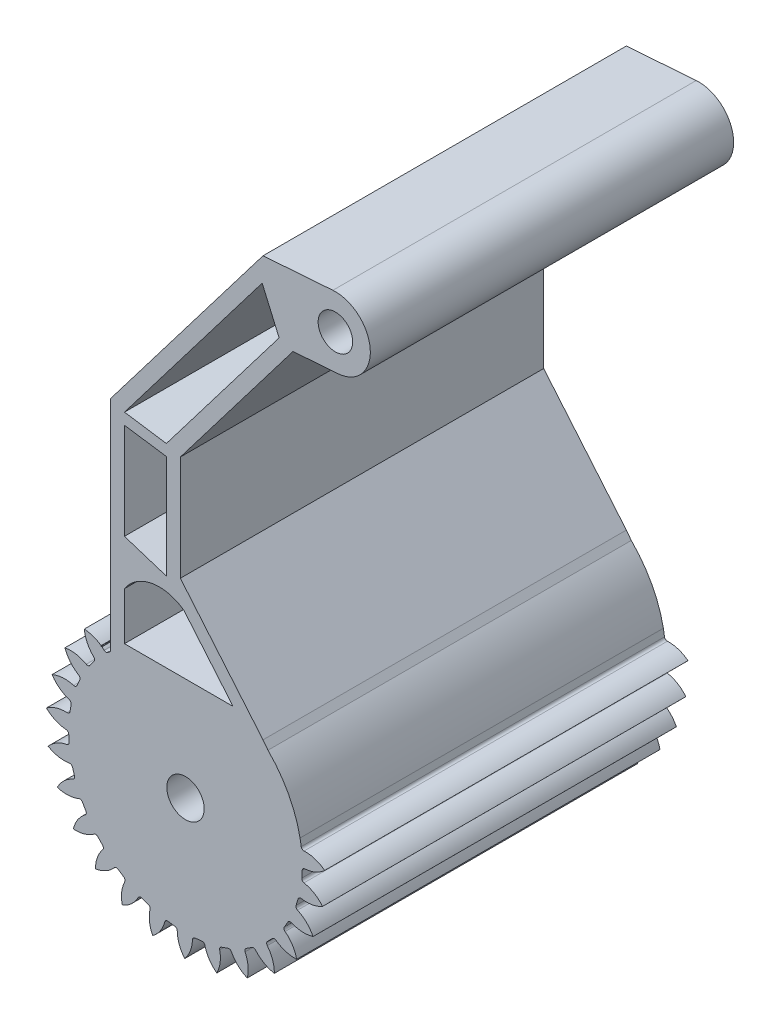
from build123d import *

# Parameters (mm, degrees)
SKETCH1_R                = 12.665001162
BOSS_EXTRUDE1_DEPTH      = 16.51
CUT_EXTRUDE1_DEPTH       = 25.359487041
FILLET1_R                = 0.255000023
CIRPATTERN1_COUNT        = 25
CIRPATTERN1_ANGLE        = 319.44
FILLET1_OF_CIRPATTERN1_R = 0.255000023
M3_CLEARANCE_HOLE1_D     = 3.4
SKETCH7_W                = 15.433030704
SKETCH7_H                = 5.386211439
CUT_EXTRUDE2_DEPTH       = 38.559608464
CLAW_PART_DEPTH          = 16.51
CLAW_PART_DEPTH_BACK     = 16.51
SKETCH8_R                = 1.57
CUT_EXTRUDE3_DEPTH       = 60.591620603


with BuildPart() as part:
    # Sketch1 → Boss-Extrude1 (new, symmetric)
    with BuildSketch(Plane.XY):
        Circle(SKETCH1_R)
    extrude(amount=BOSS_EXTRUDE1_DEPTH, both=True)

    # Sketch3 → Cut-Extrude1 (cut, symmetric)
    with BuildSketch(Plane.XY):
        with BuildLine():
            Line((-0.549568511, 10.61077849), (0.549568511, 10.61077849))
            ThreePointArc((0.549568511, 10.61077849), (1.298156627, 12.409330788), (3.016068488, 13.328000136))
            ThreePointArc((3.016068488, 13.328000136), (0, 13.665001162), (-3.016068488, 13.328000136))
            ThreePointArc((-3.016068488, 13.328000136), (-1.298156627, 12.409330788), (-0.549568511, 10.61077849))
        make_face()
    cut_extrude1 = extrude(amount=CUT_EXTRUDE1_DEPTH, both=True, mode=Mode.SUBTRACT)

    # Fillet1
    fillet1_edges = [part.edges().sort_by_distance(p)[0] for p in [
        (-0.549568511, 10.61077849, 0),
        (0.549568511, 10.61077849, 0),
    ]]
    fillet(fillet1_edges, radius=FILLET1_R)

    # CirPattern1: Cut-Extrude1 ×25 about axis, 5 skipped
    cirpattern1_axis = Axis((0, 0, 16.51), (0, 0, 1))
    add([cut_extrude1.rotate(cirpattern1_axis, i * CIRPATTERN1_ANGLE / (CIRPATTERN1_COUNT - 1)) for i in range(1, CIRPATTERN1_COUNT) if i not in (1, 2, 22, 23, 24)], mode=Mode.SUBTRACT)

    # Fillet1 of CirPattern1
    fillet1_of_cirpattern1_edges = [part.edges().sort_by_distance(p)[0] for p in [
        (-7.231966402, 7.783913391, 0),
        (-6.389116056, 8.489395841, 0),
        (-8.829715746, 5.909887103, 0),
        (-8.171921327, 6.79046004, 0),
        (-9.95310992, 3.718366394, 0),
        (-9.515709846, 4.726723161, 0),
        (-10.541797285, 1.327085424, 0),
        (-10.34828982, 2.409054488, 0),
        (-10.564152032, -1.135490008, 0),
        (-10.624932897, -0.038034824, 0),
        (-10.018973207, -3.537063979, 0),
        (-10.330777097, -2.483080806, 0),
        (-8.935549227, -5.748617724, 0),
        (-9.48162523, -4.794729265, 0),
        (-7.372084429, -7.651340856, 0),
        (-8.12309593, -6.848792465, 0),
        (-5.412572187, -9.143014166, 0),
        (-6.328172905, -8.53492082, 0),
        (-3.162282567, -10.143501106, 0),
        (-4.193284064, -9.762531151, 0),
        (-0.742106948, -10.599052929, 0),
        (-1.833121156, -10.465673057, 0),
        (1.717936576, -10.485196214, 0),
        (0.625521761, -10.606571937, 0),
        (4.085688104, -9.808047636, 0),
        (3.050560032, -10.177658336, 0),
        (6.233945898, -8.603985371, 0),
        (5.311714327, -9.201974605, 0),
        (8.047299994, -6.937694756, 0),
        (7.287509589, -7.731936996, 0),
        (9.428332319, -4.898693234, 0),
        (8.871800987, -5.846519732, 0),
        (10.302850245, -2.59652124, 0),
        (9.979476287, -3.647012305, 0),
        (10.623872406, -0.154857409, 0),
        (10.551028309, -1.251577944, 0),
        (10.374152662, 2.295125762, 0),
        (10.555751798, 1.211094421, 0),
    ]]
    fillet(fillet1_of_cirpattern1_edges, radius=FILLET1_OF_CIRPATTERN1_R)

    # M3 Clearance Hole1 (through all)
    with Locations(Plane.XY.offset(16.51)):
        with Locations((0, 0)):
            Hole(M3_CLEARANCE_HOLE1_D / 2)

    # Sketch7 → Cut-Extrude2 (cut, through all)
    with BuildSketch(Plane.XY.offset(16.51)):
        with Locations((0.047493999, 10.802685467)):
            Rectangle(SKETCH7_W, SKETCH7_H)
    extrude(amount=-CUT_EXTRUDE2_DEPTH, mode=Mode.SUBTRACT)

    # Sketch8 → claw part (add, two sides: drawn at the far end of the back side and taken through both)
    with BuildSketch(Plane.XY.offset(-CLAW_PART_DEPTH_BACK)):
        with BuildLine():
            Line((-6.817397681, 8.109579748), (-6.817397681, 28.032410915))
            Line((-6.817397681, 28.032410915), (7.045146575, 46.209579748))
            Line((7.045146575, 46.209579748), (13.395146575, 46.667743656))
            ThreePointArc((13.395146575, 46.667743656), (16.790402351, 43.729463851), (13.852122546, 40.334208075))
            Line((13.852122546, 40.334208075), (9.772359499, 40.039845841))
            Line((9.772359499, 40.039845841), (-0.467397681, 26.613032435))
            Line((-0.467397681, 26.613032435), (-0.467397681, 17.068770643))
            Line((-0.467397681, 17.068770643), (7.045146575, 8.109579748))
            Line((7.045146575, 8.109579748), (-6.817397681, 8.109579748))
        make_face()
        with Locations((13.62363456, 43.500975865)):
            Circle(SKETCH8_R, mode=Mode.SUBTRACT)
        with BuildLine():
            Line((-5.547397681, 9.379579748), (-5.547397681, 13.711072783))
            ThreePointArc((-5.547397681, 13.711072783), (-3.054532927, 15.375603898), (-0.135101553, 14.69592826))
            Line((-0.135101553, 14.69592826), (4.322812554, 9.379579748))
            Line((4.322812554, 9.379579748), (0.994520613, 9.379579748))
            Line((0.994520613, 9.379579748), (-5.547397681, 9.379579748))
        make_face(mode=Mode.SUBTRACT)
        Polygon((-5.547397681, 27.603399078), (6.968906648, 44.015319773), (8.50914458, 40.47775457), (-1.737397681, 27.042044272), align=None, mode=Mode.SUBTRACT)
        Polygon((-1.737397681, 26.015075685), (-1.737397681, 16.606769168), (-5.547397681, 17.830759902), (-5.547397681, 26.576430491), align=None, mode=Mode.SUBTRACT)
    extrude(amount=CLAW_PART_DEPTH + CLAW_PART_DEPTH_BACK)

    # Sketch9 → Cut-Extrude3 (cut, through all)
    with BuildSketch(Plane.XY.offset(16.51)):
        with BuildLine():
            Line((7.045146575, 8.109579748), (7.496898651, 7.515682795))
            ThreePointArc((7.496898651, 7.515682795), (9.449584642, 4.836768277), (10.480735691, 1.686166256))
            Line((10.480735691, 1.686166256), (13.356180839, 4.073577136))
            Line((13.356180839, 4.073577136), (7.760666424, 10.81292599))
            Line((7.760666424, 10.81292599), (7.045146575, 8.109579748))
        make_face()
    extrude(amount=-CUT_EXTRUDE3_DEPTH, mode=Mode.SUBTRACT)


solid = part.part
